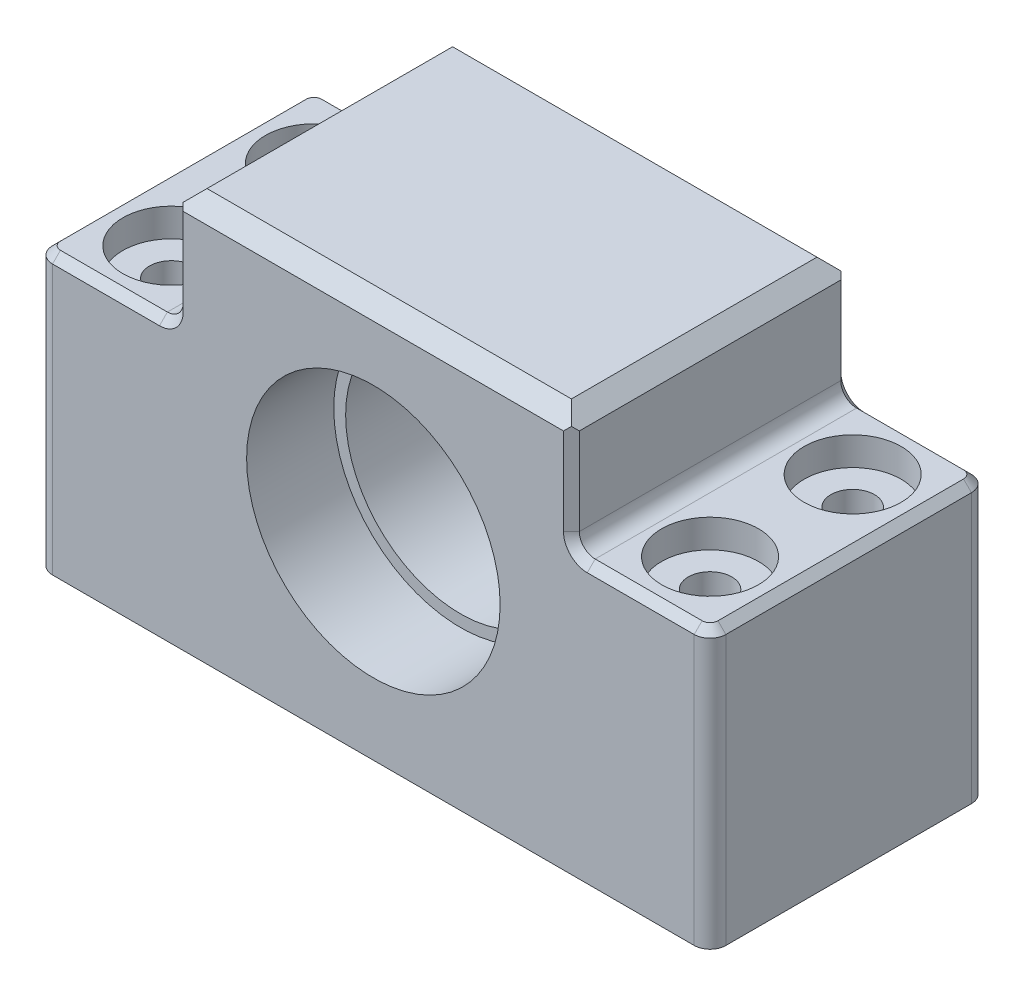
from build123d import *

# Parameters (mm, degrees)
SKETCH1_R                               = 16
BOSS_EXTRUDE1_DEPTH                     = 17.5
SKETCH2_R                               = 16
SKETCH2_R_2                             = 14.5
BOSS_EXTRUDE2_DEPTH                     = 6.5
SKETCH3_R                               = 2.6
CUT_EXTRUDE1_DEPTH                      = 58.771100041
CBORE_FOR_M5_HEX_HEAD_BOLT1_D           = 5.5
CBORE_FOR_M5_HEX_HEAD_BOLT1_CBORE_D     = 12.24
CBORE_FOR_M5_HEX_HEAD_BOLT1_CBORE_DEPTH = 3.58
CHAMFER1_SIZE                           = 2
FILLET1_R                               = 2
CHAMFER2_SIZE                           = 1


with BuildPart() as part:
    # Sketch1 → Boss-Extrude1 (new, symmetric)
    with BuildSketch(Plane.XY):
        Polygon((-25, -30), (-42.5, -30), (-42.5, 5), (-25, 5), (-25, 20), (25, 20), (25, 5), (42.5, 5), (42.5, -30), (25, -30), align=None)
        with Locations((0, -5)):
            Circle(SKETCH1_R, mode=Mode.SUBTRACT)
    extrude(amount=BOSS_EXTRUDE1_DEPTH, both=True)

    # Sketch2 → Boss-Extrude2 (add, symmetric)
    with BuildSketch(Plane.XY):
        with Locations((0, -5)):
            Circle(SKETCH2_R)
        with Locations(Location((0, -5, 0), (0, 0, 180))):
            Circle(SKETCH2_R_2, mode=Mode.SUBTRACT)
    extrude(amount=BOSS_EXTRUDE2_DEPTH, both=True)

    # Sketch3 → Cut-Extrude1 (cut, through all)
    with BuildSketch(Plane(origin=(0, 5, 0), x_dir=(1, 0, 0), z_dir=(0, 1, 0))):
        with Locations(Location((-34, 9, 0), (0, 0, 270))):
            Circle(SKETCH3_R)
        with Locations(Location((-34, -9, 0), (0, 0, 90))):
            Circle(SKETCH3_R)
        with Locations(Location((34, 9, 0), (0, 0, 90))):
            Circle(SKETCH3_R)
        with Locations(Location((34, -9, 0), (0, 0, 270))):
            Circle(SKETCH3_R)
    extrude(amount=-CUT_EXTRUDE1_DEPTH, mode=Mode.SUBTRACT)

    # CBORE for M5 Hex Head Bolt1 (through all)
    with Locations(Plane(origin=(-34, 5, -9), x_dir=(0, 0, 1), z_dir=(0, 1, 0))):
        with Locations((0, 0), (18, 0), (18, 68), (0, 68)):
            CounterBoreHole(CBORE_FOR_M5_HEX_HEAD_BOLT1_D / 2, CBORE_FOR_M5_HEX_HEAD_BOLT1_CBORE_D / 2, CBORE_FOR_M5_HEX_HEAD_BOLT1_CBORE_DEPTH)

    # Chamfer1
    chamfer1_edges = [part.edges().sort_by_distance(p)[0] for p in [
        (0, 20, -17.5),
        (-25, 20, 0),
        (25, 20, 0),
        (0, 20, 17.5),
    ]]
    chamfer(chamfer1_edges, length=CHAMFER1_SIZE)

    # Fillet1
    fillet1_edges = [part.edges().sort_by_distance(p)[0] for p in [
        (42.5, -12.5, -17.5),
        (-42.5, -12.5, 17.5),
        (-42.5, -12.5, -17.5),
        (25, 5, 0),
        (-25, 5, 0),
        (42.5, -12.5, 17.5),
    ]]
    fillet(fillet1_edges, radius=FILLET1_R)

    # Chamfer2
    chamfer2_edges = [part.edges().sort_by_distance(p)[0] for p in [
        (-33.75, 5, -17.5),
        (-42.5, 5, 0),
        (-33.75, 5, 17.5),
        (-41.914213562, 5, -16.914213562),
        (-41.914213562, 5, 16.914213562),
        (25, 12.5, 17.5),
        (33.75, 5, 17.5),
        (25, 12.5, -17.5),
        (33.75, 5, -17.5),
        (42.5, 5, 0),
        (41.914213562, 5, -16.914213562),
        (41.914213562, 5, 16.914213562),
        (-25.585786438, 5.585786438, -17.5),
        (-25.585786438, 5.585786438, 17.5),
        (25.585786438, 5.585786438, -17.5),
        (25.585786438, 5.585786438, 17.5),
        (-25, 12.5, 17.5),
        (-25, 12.5, -17.5),
    ]]
    chamfer(chamfer2_edges, length=CHAMFER2_SIZE)


solid = part.part
